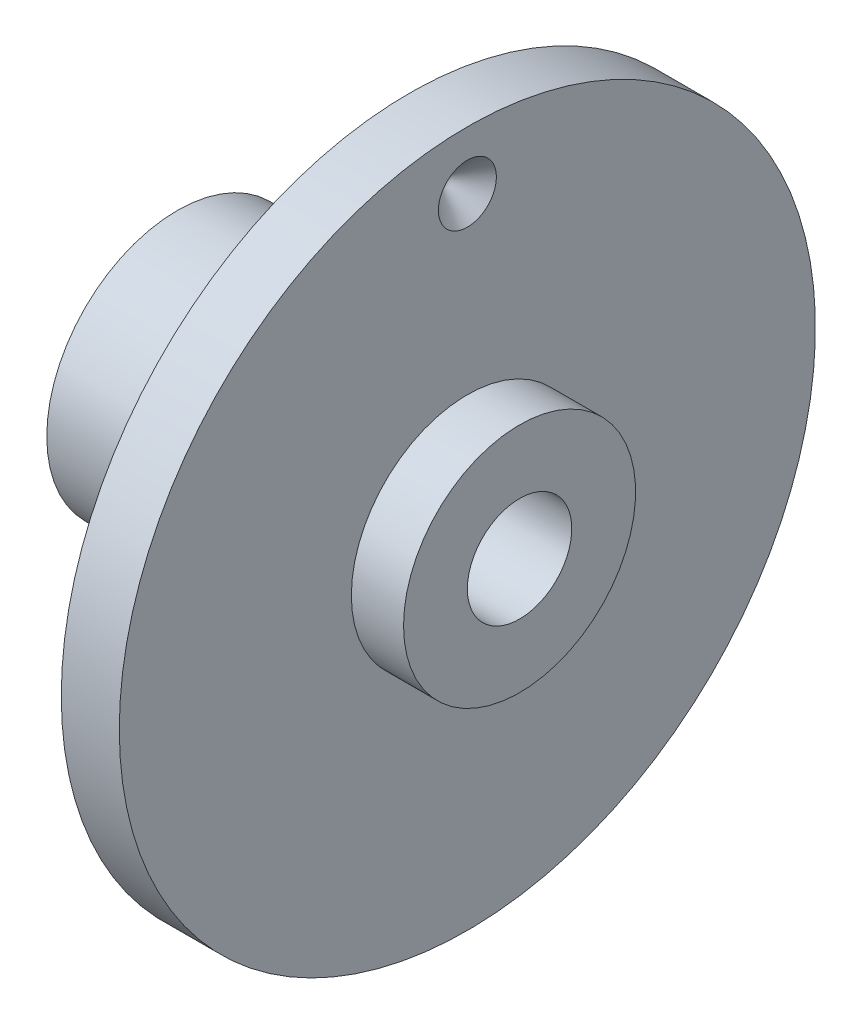
from build123d import *

# Parameters (mm, degrees)
ESQUISSE4_R             = 3.7
ENL_V_MAT_EXTRU_2_DEPTH = 25


with BuildPart() as part:
    # Esquisse1 → Base-Révolution (revolve)
    with BuildSketch(Plane.XY, mode=Mode.PRIVATE) as base_r_volution_sk:
        Polygon((0, 9), (59, 9), (59, 20), (50, 20), (50, 60), (40, 60), (40, 22.5), (0, 22.5), align=None)
    revolve(base_r_volution_sk.sketch.rotate(Axis((-20, 0, 0), (1, 0, 0)), 90), axis=Axis((-20, 0, 0), (1, 0, 0)))

    # Esquisse2 → Enlèvement de matière-Révolution1 (revolve, cut)
    with BuildSketch(Plane.XY, mode=Mode.PRIVATE) as enl_vement_de_mati_re_r_volution1_sk:
        Polygon((45, 50), (50, 55), (50, 50), align=None)
    revolve(enl_vement_de_mati_re_r_volution1_sk.sketch.rotate(Axis((21.308708687, 50, 0), (1, 0, 0)), 270), axis=Axis((21.308708687, 50, 0), (1, 0, 0)), mode=Mode.SUBTRACT)

    # Esquisse4 → Enlèv. mat.-Extru.2 (cut, symmetric)
    with BuildSketch(Plane(origin=(0, 0, 0), x_dir=(1, 0, 0), z_dir=(0, -0.7071067811865488, 0.7071067811865462))):
        with Locations(Location((15, 0, 0), (0, 0, 270))):
            Circle(ESQUISSE4_R)
    extrude(amount=ENL_V_MAT_EXTRU_2_DEPTH, both=True, mode=Mode.SUBTRACT)


solid = part.part
